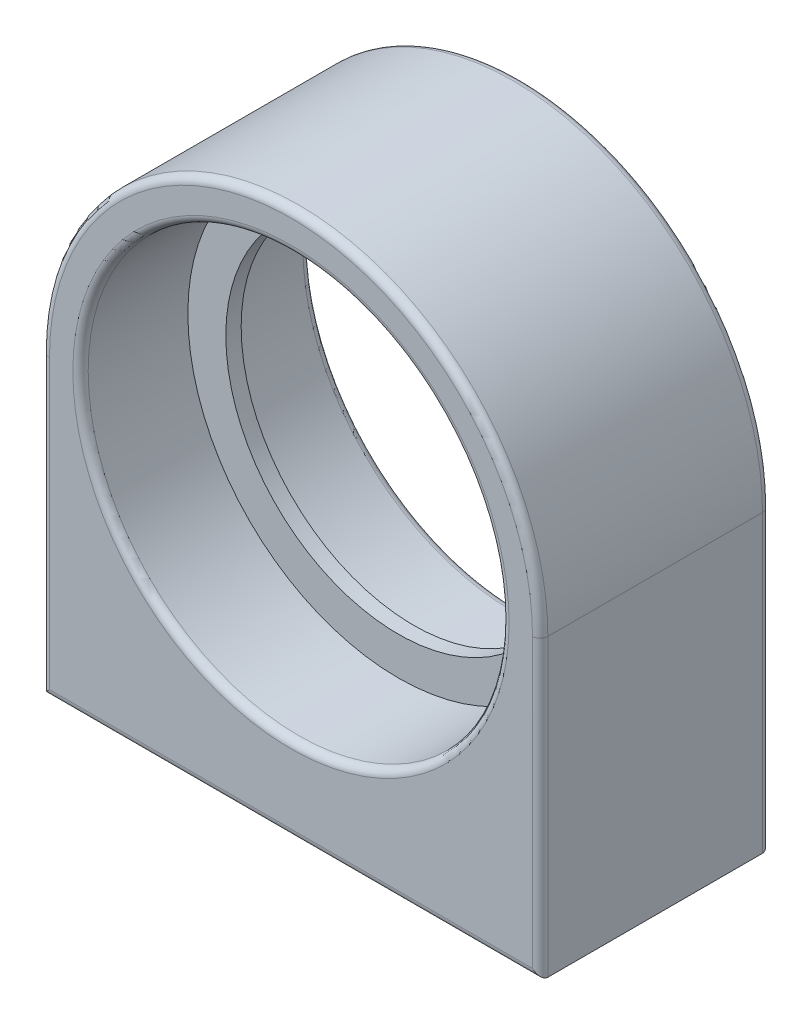
from build123d import *

# Parameters (mm, degrees)
AUFSATZ_LINEAR_AUSTRAGEN1_DEPTH = 15
SKIZZE3_R                       = 27.45
SCHNITT_LINEAR_AUSTRAGEN1_DEPTH = 14
SKIZZE4_R                       = 2.8
SCHNITT_LINEAR_AUSTRAGEN2_DEPTH = 11
VERRUNDUNG1_R                   = 1


with BuildPart() as part:
    # Skizze1 → Aufsatz-Linear austragen1 (new, symmetric)
    with BuildSketch(Plane.XY):
        with BuildLine():
            ThreePointArc((32.5, 19.25), (0, 51.75), (-32.5, 19.25))
            Line((-32.5, 19.25), (-22.5, 19.25))
            ThreePointArc((-22.5, 19.25), (0, 41.75), (22.5, 19.25))
            Line((22.5, 19.25), (32.5, 19.25))
        make_face()
        with BuildLine():
            Line((-22.5, 19.25), (-32.5, 19.25))
            ThreePointArc((-32.5, 19.25), (0, -13.25), (32.5, 19.25))
            Line((32.5, 19.25), (22.5, 19.25))
            ThreePointArc((22.5, 19.25), (0, -3.25), (-22.5, 19.25))
        make_face()
        with BuildLine():
            Line((-32.5, 19.25), (-32.5, -19.25))
            Line((-32.5, -19.25), (32.5, -19.25))
            Line((32.5, -19.25), (32.5, 19.25))
            ThreePointArc((32.5, 19.25), (0, -13.25), (-32.5, 19.25))
        make_face()
    extrude(amount=AUFSATZ_LINEAR_AUSTRAGEN1_DEPTH, both=True)

    # Skizze3 → Schnitt-Linear austragen1 (cut)
    with BuildSketch(Plane.XY.offset(15)):
        with Locations((0, 19.25)):
            Circle(SKIZZE3_R)
    schnitt_linear_austragen1 = extrude(amount=-SCHNITT_LINEAR_AUSTRAGEN1_DEPTH, mode=Mode.SUBTRACT)

    # Spiegeln1: Schnitt-Linear austragen1 across plane
    add(schnitt_linear_austragen1.mirror(Plane.XY), mode=Mode.SUBTRACT)

    # Skizze4 → Schnitt-Linear austragen2 (cut)
    with BuildSketch(Plane.XZ.offset(19.25)):
        with Locations(Location((-22.5, 0, 0), (0, 0, 270))):
            Circle(SKIZZE4_R)
        with Locations(Location((-10, 0, 0), (0, 0, 270))):
            Circle(SKIZZE4_R)
        with Locations(Location((10, 0, 0), (0, 0, 90))):
            Circle(SKIZZE4_R)
        with Locations(Location((22.5, 0, 0), (0, 0, 90))):
            Circle(SKIZZE4_R)
    extrude(amount=-SCHNITT_LINEAR_AUSTRAGEN2_DEPTH, mode=Mode.SUBTRACT)

    # Verrundung1
    verrundung1_edges = [part.edges().sort_by_distance(p)[0] for p in [
        (-32.5, 0, 15),
        (0, -19.25, 15),
        (32.5, 0, 15),
        (-27.45, 19.25, 15),
        (-27.45, 19.25, -15),
        (-22.5, -19.25, 2.8),
        (-10, -19.25, 2.8),
        (10, -19.25, -2.8),
        (22.5, -19.25, -2.8),
        (0, 51.75, 15),
        (32.5, 0, -15),
        (0, -19.25, -15),
        (-32.5, 0, -15),
        (0, 51.75, -15),
    ]]
    fillet(verrundung1_edges, radius=VERRUNDUNG1_R)


solid = part.part
